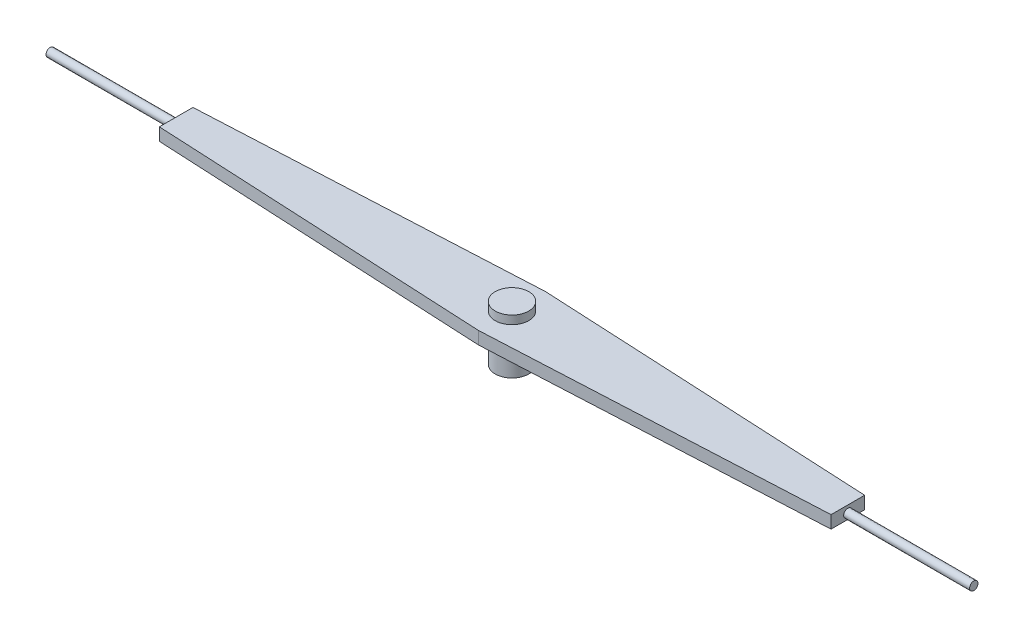
from build123d import *

# Parameters (mm, degrees)
SKETCH1_W           = 400
SKETCH1_H           = 20
BOSS_EXTRUDE1_DEPTH = 7.5
SKETCH2_R           = 2.5
BOSS_EXTRUDE2_DEPTH = 75
SKETCH3_R           = 2.5
BOSS_EXTRUDE3_DEPTH = 75
SKETCH5_R           = 10
BOSS_EXTRUDE4_DEPTH = 5
BOSS_EXTRUDE5_START = 20
SKETCH6_R           = 10
BOSS_EXTRUDE5_DEPTH = 20
SKETCH7_R           = 8
CUT_EXTRUDE1_DEPTH  = 15


with BuildPart() as part:
    # Sketch1 → Boss-Extrude1 (new body)
    with BuildSketch(Plane(origin=(0, 0, 0), x_dir=(1, 0, 0), z_dir=(0, 1, 0))):
        Rectangle(SKETCH1_W, SKETCH1_H)
        Polygon((200, 10), (0, 20), (-200, 10), align=None)
        Polygon((0, -20), (-200, -10), (200, -10), align=None)
    extrude(amount=BOSS_EXTRUDE1_DEPTH)

    # Sketch2 → Boss-Extrude2 (add)
    with BuildSketch(Plane(origin=(200, 0, 0), x_dir=(0, 0, -1), z_dir=(1, 0, 0))):
        with Locations((0, 3.296264787)):
            Circle(SKETCH2_R)
    extrude(amount=BOSS_EXTRUDE2_DEPTH)

    # Sketch3 → Boss-Extrude3 (add)
    with BuildSketch(Plane.ZY.offset(200)):
        with Locations((0, 3.469116297)):
            Circle(SKETCH3_R)
    extrude(amount=BOSS_EXTRUDE3_DEPTH)

    # Sketch5 → Boss-Extrude4 (add)
    with BuildSketch(Plane(origin=(0, 7.5, 0), x_dir=(1, 0, 0), z_dir=(0, 1, 0))):
        with Locations(Location((0, 0, 0), (0, 0, 270))):
            Circle(SKETCH5_R)
    extrude(amount=BOSS_EXTRUDE4_DEPTH)

    # Sketch6 → Boss-Extrude5 (add)
    with BuildSketch(Plane.XZ.offset(BOSS_EXTRUDE5_START)):
        with Locations(Location((0, 0, 0), (0, 0, 90))):
            Circle(SKETCH6_R)
    extrude(amount=-BOSS_EXTRUDE5_DEPTH)

    # Sketch7 → Cut-Extrude1 (cut)
    with BuildSketch(Plane(origin=(0, -20, 0), x_dir=(-1, 0, 0), z_dir=(0, -1, 0))):
        with Locations(Location((0, 0, 0), (0, 0, 90))):
            Circle(SKETCH7_R)
    extrude(amount=-CUT_EXTRUDE1_DEPTH, mode=Mode.SUBTRACT)


solid = part.part
